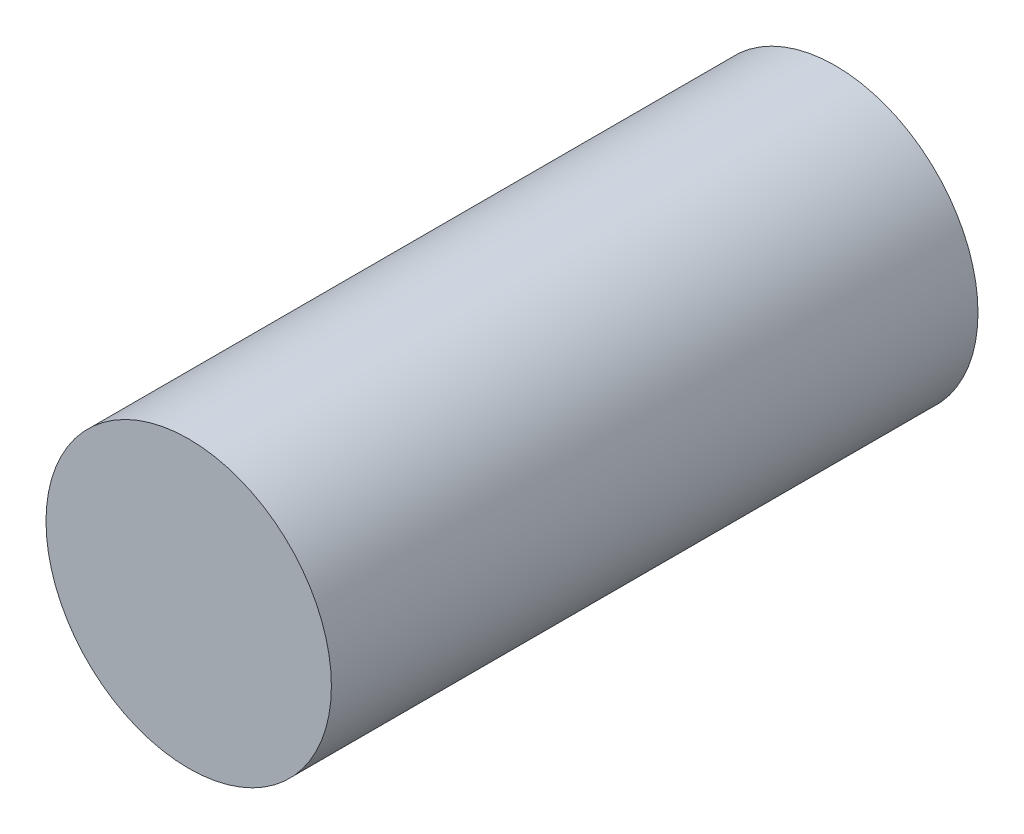
from build123d import *

# Parameters (mm, degrees)
SKETCH1_R           = 3.2
BOSS_EXTRUDE1_DEPTH = 14.5
SCALE_1_SCALE       = 2


with BuildPart() as part:
    # Sketch1 → Boss-Extrude1 (new body)
    with BuildSketch(Plane.XY):
        with Locations(Location((0, 0, 0), (0, 0, 180))):
            Circle(SKETCH1_R)
    extrude(amount=BOSS_EXTRUDE1_DEPTH)


with BuildPart() as part_1:
    # 缩放比例1: scaled about (0, 0, 7.25)
    add(part.part.scale(SCALE_1_SCALE).moved(Location((0, 0, -7.25))))


solid = part_1.part
